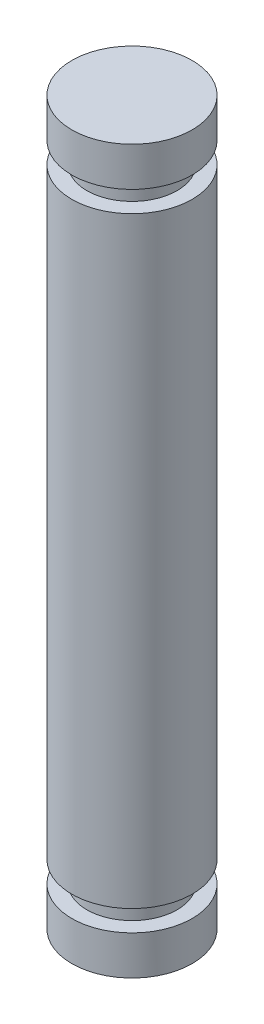
from build123d import *

# Parameters (mm, degrees)
SKETCH_1_R          = 2
EXTRUDE_1_DEPTH     = 24
CUT_EXTRUDE_START   = -2
SKETCH_2_R          = 2
SKETCH_2_R_2        = 1.5
CUT_EXTRUDE_1_DEPTH = 0.7
CUT_EXTRUDE_START_2 = -1.3
SKETCH_3_R          = 2
SKETCH_3_R_2        = 1.5
CUT_EXTRUDE_2_DEPTH = 0.7


with BuildPart() as part:
    # 스케치1 → 보스-돌출1 (new body)
    with BuildSketch(Plane(origin=(0, 0, 0), x_dir=(1, 0, 0), z_dir=(0, 1, 0))):
        with Locations(Location((0, 0, 0), (0, 0, 270))):
            Circle(SKETCH_1_R)
    extrude(amount=EXTRUDE_1_DEPTH)

    # 스케치2 → 컷-돌출1 (cut)
    with BuildSketch(Plane(origin=(0, 24, 0), x_dir=(1, 0, 0), z_dir=(0, 1, 0)).offset(CUT_EXTRUDE_START)):
        with Locations(Location((0, 0, 0), (0, 0, 270))):
            Circle(SKETCH_2_R)
        with Locations(Location((0, 0, 0), (0, 0, 270))):
            Circle(SKETCH_2_R_2, mode=Mode.SUBTRACT)
    extrude(amount=CUT_EXTRUDE_1_DEPTH, mode=Mode.SUBTRACT)

    # 스케치3 → 컷-돌출2 (cut)
    with BuildSketch(Plane.XZ.offset(CUT_EXTRUDE_START_2)):
        with Locations(Location((0, 0, 0), (0, 0, 270))):
            Circle(SKETCH_3_R)
        with Locations(Location((0, 0, 0), (0, 0, 90))):
            Circle(SKETCH_3_R_2, mode=Mode.SUBTRACT)
    extrude(amount=-CUT_EXTRUDE_2_DEPTH, mode=Mode.SUBTRACT)


solid = part.part
